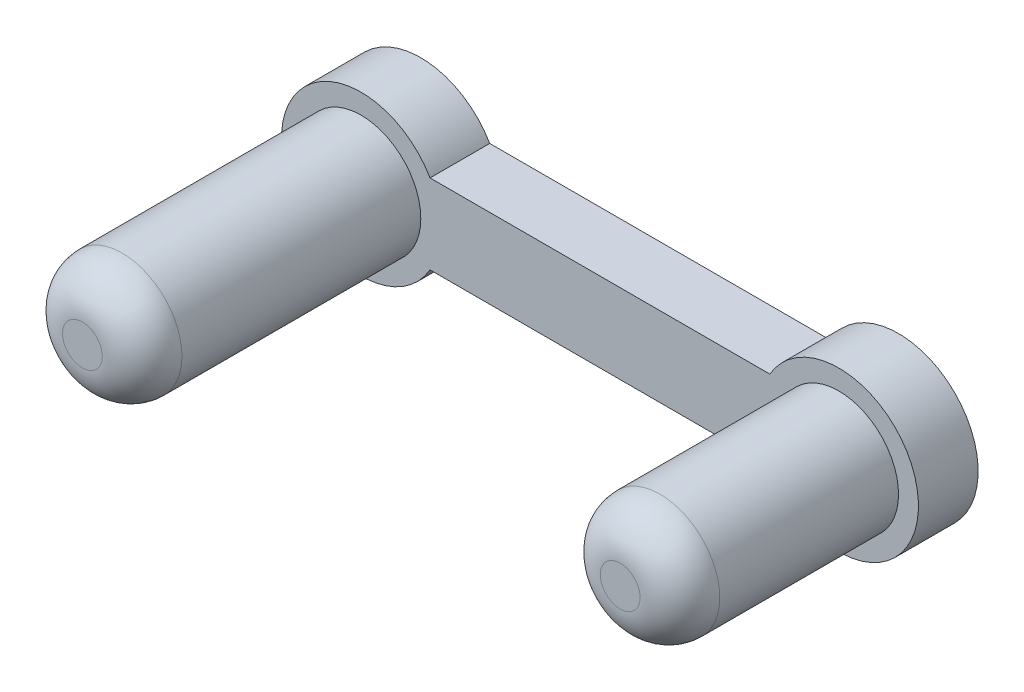
from build123d import *

# Parameters (mm, degrees)
SKETCH1_W               = 150
SKETCH1_H               = 90
BOSS_EXTRUDE1_DEPTH     = 70
SHELL4_T                = -5
SKETCH2_R               = 20
BOSS_EXTRUDE2_DEPTH     = 2.5
SKETCH3_R               = 7.5
BOSS_EXTRUDE3_DEPTH     = 35
SKETCH4_W               = 65
SKETCH4_H               = 4.658499389
CUT_EXTRUDE1_DEPTH      = 189.414436814
SKETCH6_W               = 3
SKETCH6_H               = 3
CUT_EXTRUDE3_DEPTH      = 40
FILLET4_R               = 5
FILLET5_R               = 5
SKETCH10_W              = 3
SKETCH10_H              = 3
CUT_EXTRUDE4_DEPTH      = 40
CUT_EXTRUDE5_DEPTH      = 187.614576065
CUT_EXTRUDE5_DEPTH_BACK = 187.614576065
SKETCH11_W              = 3
SKETCH11_H              = 3
SKETCH11_R              = 20
SKETCH12_W              = 30
SKETCH12_H              = 10
BOSS_EXTRUDE4_DEPTH     = 7.5
CUT_EXTRUDE8_DEPTH      = 146.17231141
CUT_EXTRUDE8_DEPTH_BACK = 146.17231141


with BuildPart() as part:
    # Sketch1 → Boss-Extrude1 (new body)
    with BuildSketch(Plane.XY):
        with Locations((75, -45)):
            Rectangle(SKETCH1_W, SKETCH1_H)
    extrude(amount=BOSS_EXTRUDE1_DEPTH)

    # Shell4
    shell4_openings = [part.faces().sort_by_distance(p)[0] for p in [
        (75, -45, 70),
    ]]
    offset(amount=SHELL4_T, openings=shell4_openings, kind=Kind.INTERSECTION)

    # Sketch2 → Boss-Extrude2 (add)
    with BuildSketch(Plane.XY.offset(5)):
        with Locations((45, -45)):
            Circle(SKETCH2_R)
        with Locations((105, -45)):
            Circle(SKETCH2_R)
    extrude(amount=BOSS_EXTRUDE2_DEPTH)

    # Sketch3 → Boss-Extrude3 (add)
    with BuildSketch(Plane.XY.offset(7.5)):
        with Locations((45, -45)):
            Circle(SKETCH3_R)
        with Locations((105, -45)):
            Circle(SKETCH3_R)
    extrude(amount=BOSS_EXTRUDE3_DEPTH)

    # Sketch4 → Cut-Extrude1 (cut, through all)
    with BuildSketch(Plane.XZ.offset(90)):
        Polygon((85, 70), (85, 49.954434269), (85, 34.954434269), (150, 34.954434269), (150, 70), align=None)
        with Locations((117.5, 72.329249694)):
            Rectangle(SKETCH4_W, SKETCH4_H)
    extrude(amount=-CUT_EXTRUDE1_DEPTH, mode=Mode.SUBTRACT)

    # Sketch6 → Cut-Extrude3 (cut)
    with BuildSketch(Plane.XY.offset(34.954434269)):
        with Locations((96.5, -2.5)):
            Rectangle(SKETCH6_W, SKETCH6_H)
        with Locations((113.5, -2.5)):
            Rectangle(SKETCH6_W, SKETCH6_H)
        with Locations((96.5, -87.5)):
            Rectangle(SKETCH6_W, SKETCH6_H)
        with Locations((113.5, -87.5)):
            Rectangle(SKETCH6_W, SKETCH6_H)
    extrude(amount=-CUT_EXTRUDE3_DEPTH, mode=Mode.SUBTRACT)

    # Fillet4
    fillet4_edges = [part.edges().sort_by_distance(p)[0] for p in [
        (5, -5, 37.5),
        (5, -85, 37.5),
        (145, -5, 19.977217134),
        (145, -85, 19.977217134),
        (150, 0, 17.477217134),
        (150, -90, 17.477217134),
        (85, -87.5, 70),
        (85, -87.5, 34.954434269),
        (85, -2.5, 70),
        (85, -2.5, 34.954434269),
        (0, 0, 35),
        (0, -90, 35),
    ]]
    fillet(fillet4_edges, radius=FILLET4_R)

    # Fillet5
    fillet5_edges = [part.edges().sort_by_distance(p)[0] for p in [
        (37.5, -45, 42.5),
        (97.5, -45, 34.954434269),
    ]]
    fillet(fillet5_edges, radius=FILLET5_R)

    # Sketch10 → Cut-Extrude4 (cut)
    with BuildSketch(Plane.XY.offset(70)):
        with Locations((2.5, -45)):
            Rectangle(SKETCH10_W, SKETCH10_H)
        with Locations((37.5, -87.5)):
            Rectangle(SKETCH10_W, SKETCH10_H)
        with Locations((37.5, -2.5)):
            Rectangle(SKETCH10_W, SKETCH10_H)
    extrude(amount=-CUT_EXTRUDE4_DEPTH, mode=Mode.SUBTRACT)

    # Sketch11 → Cut-Extrude5 (cut, two sides: drawn at the far end of the back side and taken through both)
    # profile 1 of 4: a face of its own
    with BuildSketch(Plane.XY.offset(5).offset(-CUT_EXTRUDE5_DEPTH_BACK)):
        with BuildLine():
            Line((85, -5), (85, 0))
            Line((85, 0), (80, 0))
            Line((80, 0), (5, 0))
            ThreePointArc((5, 0), (1.464466094, -1.464466094), (0, -5))
            Line((0, -5), (0, -85))
            ThreePointArc((0, -85), (1.464466094, -88.535533906), (5, -90))
            Line((5, -90), (80, -90))
            Line((80, -90), (85, -90))
            Line((85, -90), (85, -85))
            Line((85, -85), (80, -85))
            Line((80, -85), (10, -85))
            ThreePointArc((10, -85), (6.464466094, -83.535533906), (5, -80))
            Line((5, -80), (5, -10))
            ThreePointArc((5, -10), (6.464466094, -6.464466094), (10, -5))
            Line((10, -5), (80, -5))
            Line((80, -5), (85, -5))
        make_face()
        with Locations((37.5, -87.5)):
            Rectangle(SKETCH11_W, SKETCH11_H, mode=Mode.SUBTRACT)
        with Locations((2.5, -45)):
            Rectangle(SKETCH11_W, SKETCH11_H, mode=Mode.SUBTRACT)
        with Locations((37.5, -2.5)):
            Rectangle(SKETCH11_W, SKETCH11_H, mode=Mode.SUBTRACT)
    # profile 2 of 4: a face of its own
    with BuildSketch(Plane.XY.offset(5).offset(-CUT_EXTRUDE5_DEPTH_BACK)):
        with BuildLine():
            ThreePointArc((140, -85), (143.535533906, -83.535533906), (145, -80))
            Line((145, -80), (145, -10))
            ThreePointArc((145, -10), (143.535533906, -6.464466094), (140, -5))
            Line((140, -5), (10, -5))
            ThreePointArc((10, -5), (6.464466094, -6.464466094), (5, -10))
            Line((5, -10), (5, -80))
            ThreePointArc((5, -80), (6.464466094, -83.535533906), (10, -85))
            Line((10, -85), (140, -85))
        make_face()
        with Locations((105, -45)):
            Circle(SKETCH11_R, mode=Mode.SUBTRACT)
        with Locations((45, -45)):
            Circle(SKETCH11_R, mode=Mode.SUBTRACT)
    # profile 3 of 4: a face of its own
    with BuildSketch(Plane.XY.offset(5).offset(-CUT_EXTRUDE5_DEPTH_BACK)):
        with BuildLine():
            Line((145, 0), (90, 0))
            Line((90, 0), (85, 0))
            Line((85, 0), (85, -5))
            Line((85, -5), (90, -5))
            Line((90, -5), (140, -5))
            ThreePointArc((140, -5), (143.535533906, -6.464466094), (145, -10))
            Line((145, -10), (145, -80))
            ThreePointArc((145, -80), (143.535533906, -83.535533906), (140, -85))
            Line((140, -85), (90, -85))
            Line((90, -85), (85, -85))
            Line((85, -85), (85, -90))
            Line((85, -90), (90, -90))
            Line((90, -90), (145, -90))
            ThreePointArc((145, -90), (148.535533906, -88.535533906), (150, -85))
            Line((150, -85), (150, -5))
            ThreePointArc((150, -5), (148.535533906, -1.464466094), (145, 0))
        make_face()
    # profile 4 of 4: a face of its own
    with BuildSketch(Plane.XY.offset(5).offset(-CUT_EXTRUDE5_DEPTH_BACK)):
        with Locations((2.5, -45)):
            Rectangle(SKETCH11_W, SKETCH11_H)
    extrude(amount=CUT_EXTRUDE5_DEPTH + CUT_EXTRUDE5_DEPTH_BACK, mode=Mode.SUBTRACT)


with BuildPart() as cut_extrude5_piece_1:
    # of the separate pieces the step leaves, piece 1, a body of its own (cut_extrude5_pieces_kept)
    add(part.part.solids().sort_by_distance((65, -45, 7.5))[0])



with BuildPart() as cut_extrude5_piece_2:
    # of the separate pieces the step leaves, piece 2, a body of its own (cut_extrude5_pieces_kept)
    add(part.part.solids().sort_by_distance((112.5, -45, 29.954434269))[0])


with BuildPart() as cut_extrude5_piece_1_1:
    add(cut_extrude5_piece_1.part)

    add(cut_extrude5_piece_2.part)  # Boss-Extrude4 merges Cut-Extrude5 piece 2
    # Sketch12 → Boss-Extrude4 (add)
    with BuildSketch(Plane.XY.offset(7.5)):
        with Locations((75, -45)):
            Rectangle(SKETCH12_W, SKETCH12_H)
    extrude(amount=-BOSS_EXTRUDE4_DEPTH)

    # Sketch13 → Cut-Extrude8 (cut, two sides: drawn at the far end of the back side and taken through both)
    with BuildSketch(Plane.XY.offset(7.5).offset(-CUT_EXTRUDE8_DEPTH_BACK)):
        with BuildLine():
            ThreePointArc((64.364916731, -40), (25, -45), (64.364916731, -50))
            Line((64.364916731, -50), (53.660254038, -50))
            ThreePointArc((53.660254038, -50), (35, -45), (53.660254038, -40))
            Line((53.660254038, -40), (64.364916731, -40))
        make_face()
        with BuildLine():
            Line((96.339745962, -50), (85.635083269, -50))
            ThreePointArc((85.635083269, -50), (107.52008585, -64.840593925), (125, -45))
            ThreePointArc((125, -45), (107.52008585, -25.159406075), (85.635083269, -40))
            Line((85.635083269, -40), (96.339745962, -40))
            ThreePointArc((96.339745962, -40), (107.588190451, -35.340741737), (115, -45))
            ThreePointArc((115, -45), (107.588190451, -54.659258263), (96.339745962, -50))
        make_face()
    extrude(amount=CUT_EXTRUDE8_DEPTH + CUT_EXTRUDE8_DEPTH_BACK, mode=Mode.SUBTRACT)


solid = cut_extrude5_piece_1_1.part
